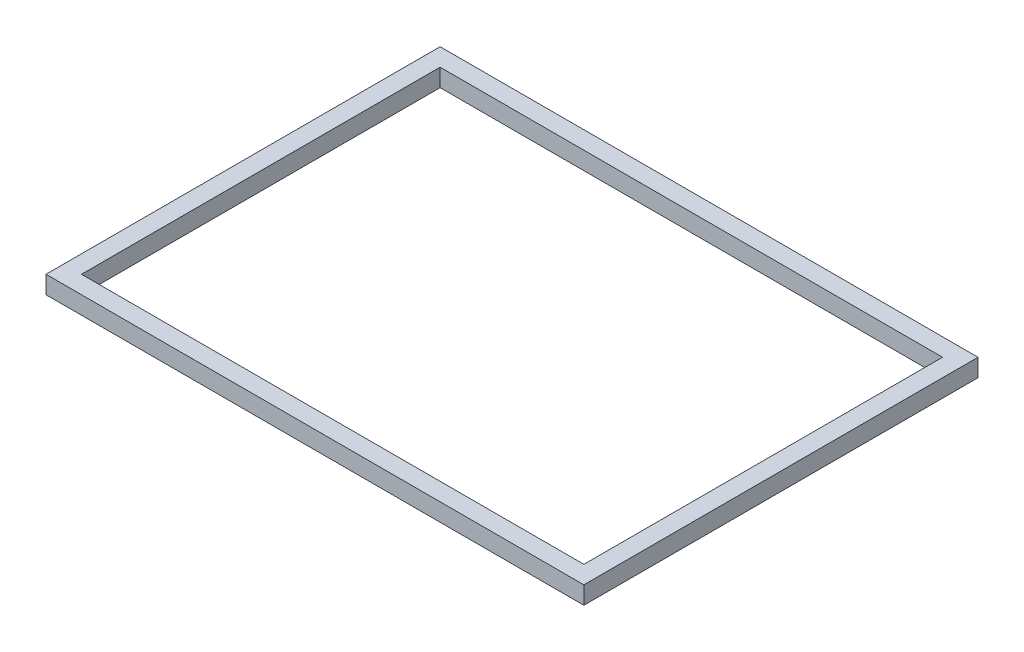
from build123d import *

# Parameters (mm, degrees)
SKETCH1_W           = 914.4
SKETCH1_H           = 670
SKETCH1_W_2         = 854.075
SKETCH1_H_2         = 609.675
BOSS_EXTRUDE1_DEPTH = 30.1625


with BuildPart() as part:
    # Sketch1 → Boss-Extrude1 (new body)
    with BuildSketch(Plane(origin=(0, 0, 0), x_dir=(1, 0, 0), z_dir=(0, 1, 0))):
        Rectangle(SKETCH1_W, SKETCH1_H)
        Rectangle(SKETCH1_W_2, SKETCH1_H_2, mode=Mode.SUBTRACT)
    extrude(amount=BOSS_EXTRUDE1_DEPTH)


solid = part.part
